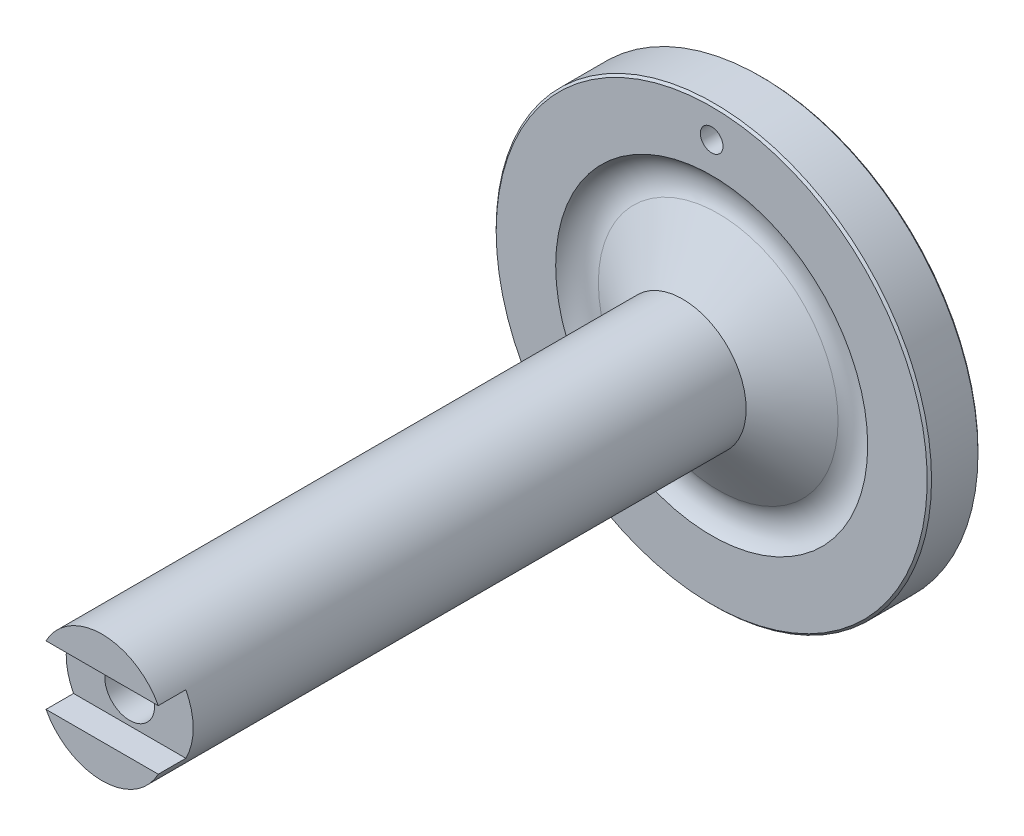
from build123d import *

# Parameters (mm, degrees)
CHAMFER1_SIZE           = 0.762
CUT_EXTRUDE1_DEPTH      = 256.026625277
CUT_EXTRUDE1_DEPTH_BACK = 256.026625277
SKETCH2_W               = 9.652
SKETCH2_H               = 20.7772
SKETCH3_R               = 3.9624
CUT_EXTRUDE2_DEPTH      = 256.026625277


with BuildPart() as part:
    # Sketch1 → Revolve1 (revolve)
    with BuildSketch(Plane(origin=(0, 0, 0), x_dir=(0, 0, -1), z_dir=(1, 0, 0)), mode=Mode.PRIVATE) as revolve1_sk:
        with BuildLine():
            Line((0, 8.7376), (0, 22.225))
            Line((0, 22.225), (203.2, 22.225))
            Line((203.2, 22.225), (215.644604414, 41.950024019))
            ThreePointArc((215.644604414, 41.950024019), (216.962465562, 48.723970202), (213.36, 54.61))
            Line((213.36, 54.61), (213.36, 76.2))
            Line((213.36, 76.2), (231.14, 76.2))
            Line((231.14, 76.2), (231.14, 54.61))
            Line((231.14, 54.61), (217.150682631, 32.43656548))
            ThreePointArc((217.150682631, 32.43656548), (215.740333448, 26.296391433), (218.471224769, 20.618975231))
            Line((218.471224769, 20.618975231), (223.2152, 15.875))
            Line((223.2152, 15.875), (223.2152, 8.7376))
            Line((223.2152, 8.7376), (0, 8.7376))
        make_face()
    revolve(revolve1_sk.sketch.rotate(Axis((0, 0, 0), (0, 0, -1)), 90), axis=Axis((0, 0, 0), (0, 0, -1)))

    # Chamfer1
    chamfer1_edges = [part.edges().sort_by_distance(p)[0] for p in [
        (-76.2, 0, -231.14),
        (-76.2, 0, -213.36),
    ]]
    chamfer(chamfer1_edges, length=CHAMFER1_SIZE)

    # Sketch2 → Cut-Extrude1 (cut, two sides: drawn at the far end of the back side and taken through both)
    with BuildSketch(Plane(origin=(0, 0, 0), x_dir=(0, 0, -1), z_dir=(1, 0, 0)).offset(-CUT_EXTRUDE1_DEPTH_BACK)):
        with Locations((4.826, 0)):
            Rectangle(SKETCH2_W, SKETCH2_H)
    extrude(amount=CUT_EXTRUDE1_DEPTH + CUT_EXTRUDE1_DEPTH_BACK, mode=Mode.SUBTRACT)

    # Sketch3 → Cut-Extrude2 (cut, through all)
    with BuildSketch(Plane(origin=(0, 0, -231.14), x_dir=(-1, 0, 0), z_dir=(0, 0, -1))):
        with Locations((0, 65.405)):
            Circle(SKETCH3_R)
    extrude(amount=-CUT_EXTRUDE2_DEPTH, mode=Mode.SUBTRACT)


solid = part.part
